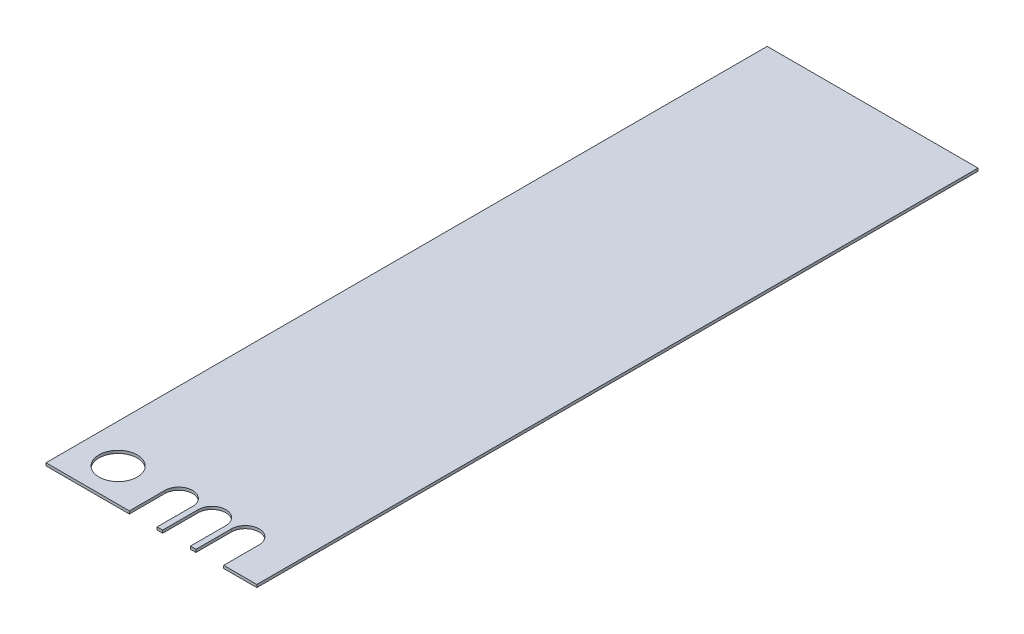
from build123d import *

# Parameters (mm, degrees)
SKETCH1_W           = 482.6
SKETCH1_H           = 1651
BOSS_EXTRUDE1_DEPTH = 6.35
SKETCH2_R           = 43.923649364
CUT_EXTRUDE1_DEPTH  = 861.067591821
CUT_EXTRUDE3_DEPTH  = 861.067591821


with BuildPart() as part:
    # Sketch1 → Boss-Extrude1 (new body)
    with BuildSketch(Plane(origin=(0, 0, 0), x_dir=(1, 0, 0), z_dir=(0, 1, 0))):
        Rectangle(SKETCH1_W, SKETCH1_H)
    extrude(amount=BOSS_EXTRUDE1_DEPTH)

    # Sketch2 → Cut-Extrude1 (cut, through all)
    with BuildSketch(Plane(origin=(0, 6.35, 0), x_dir=(1, 0, 0), z_dir=(0, 1, 0))):
        with Locations(Location((-152.4, -749.3, 0), (0, 0, 270))):
            Circle(SKETCH2_R)
    extrude(amount=-CUT_EXTRUDE1_DEPTH, mode=Mode.SUBTRACT)

    # Sketch4 → Cut-Extrude3 (cut, through all)
    with BuildSketch(Plane.XZ):
        with BuildLine():
            Line((-50.444519558, 744.293611593), (-50.444519558, 825.5))
            Line((-50.444519558, 825.5), (13.055480442, 825.5))
            Line((13.055480442, 825.5), (13.055480442, 744.293611593))
            ThreePointArc((13.055480442, 744.293611593), (-18.694519558, 712.543611593), (-50.444519558, 744.293611593))
        make_face()
        with BuildLine():
            Line((25.755480442, 744.293611593), (25.755480442, 825.5))
            Line((25.755480442, 825.5), (89.255480442, 825.5))
            Line((89.255480442, 825.5), (89.255480442, 744.293611593))
            ThreePointArc((89.255480442, 744.293611593), (57.505480442, 712.543611593), (25.755480442, 744.293611593))
        make_face()
        with BuildLine():
            Line((101.955480442, 744.293611593), (101.955480442, 825.5))
            Line((101.955480442, 825.5), (165.455480442, 825.5))
            Line((165.455480442, 825.5), (165.455480442, 744.293611593))
            ThreePointArc((165.455480442, 744.293611593), (133.705480442, 712.543611593), (101.955480442, 744.293611593))
        make_face()
    extrude(amount=-CUT_EXTRUDE3_DEPTH, mode=Mode.SUBTRACT)


solid = part.part
